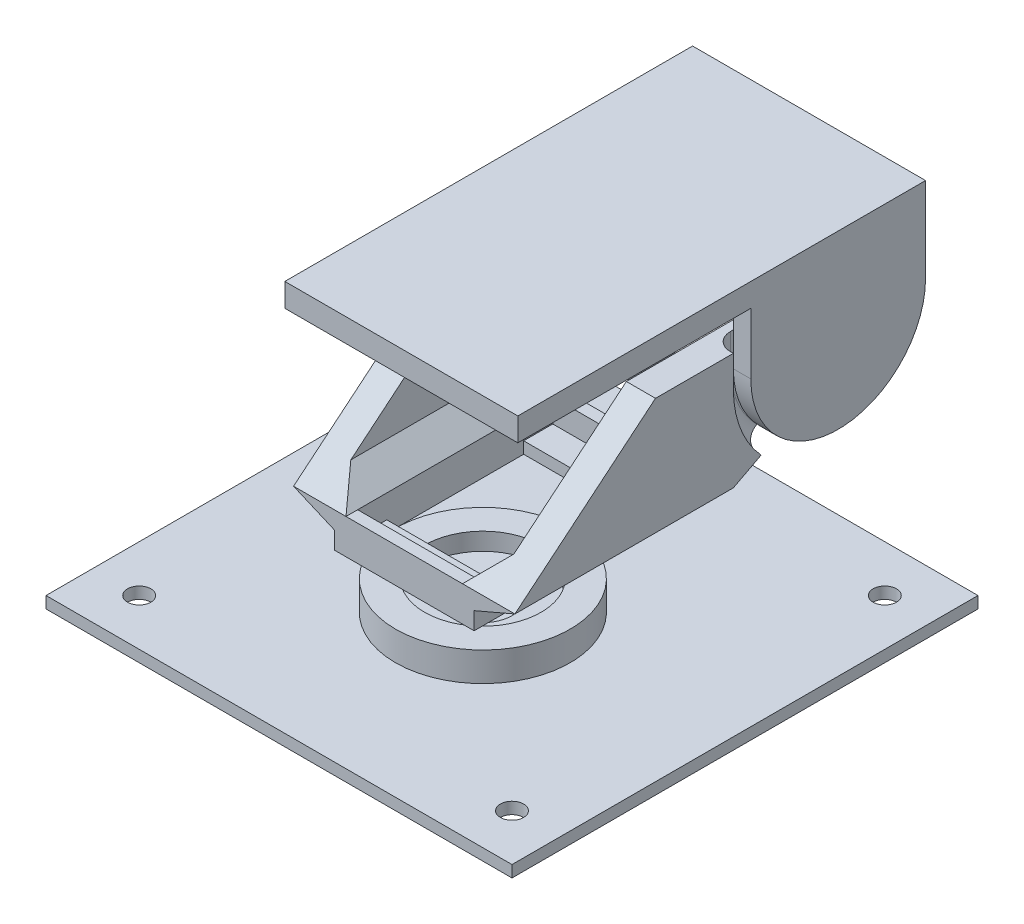
from build123d import *

# Parameters (mm, degrees)
SKETCH1_W            = 80
SKETCH1_H            = 80
BOSS_EXTRUDE1_DEPTH  = 2
SKETCH2_R            = 15
SKETCH2_R_2          = 5
BOSS_EXTRUDE2_DEPTH  = 5
SKETCH13_R           = 10
CUT_EXTRUDE1_DEPTH   = 3
BOSS_EXTRUDE3_START  = 10
SKETCH4_W            = 24
SKETCH4_H            = 37.5
SKETCH4_W_2          = 20
SKETCH4_H_2          = 33.5
BOSS_EXTRUDE3_DEPTH  = 6
BOSS_EXTRUDE4_START  = 2
SKETCH5_R            = 1.3
BOSS_EXTRUDE4_DEPTH  = 5
BOSS_EXTRUDE5_REACH  = 83.879
SKETCH10_W           = 20
SKETCH10_H           = 5
BOSS_EXTRUDE8_DEPTH  = 2
CUT_EXTRUDE3_DEPTH   = 10
SKETCH9_R            = 1.3
BOSS_EXTRUDE7_DEPTH  = 2
SKETCH14_R           = 2
CUT_EXTRUDE2_DEPTH   = 2
BOSS_EXTRUDE11_START = 33
SKETCH9_3_R          = 1.3
BOSS_EXTRUDE11_DEPTH = 2
BOSS_EXTRUDE6_START  = 5.195652
SKETCH7_W            = 40
SKETCH7_H            = 70
BOSS_EXTRUDE6_DEPTH  = 4
BOSS_EXTRUDE12_START = 22
BOSS_EXTRUDE12_DEPTH = 3
BOSS_EXTRUDE13_DEPTH = 3
CUT_EXTRUDE4_DEPTH   = 3.5
FILLET1_R            = 3


with BuildPart() as part:
    # Sketch1 → Boss-Extrude1 (new body)
    with BuildSketch(Plane(origin=(0, 0, 0), x_dir=(1, 0, 0), z_dir=(0, 1, 0))):
        Rectangle(SKETCH1_W, SKETCH1_H)
    extrude(amount=BOSS_EXTRUDE1_DEPTH)

    # Sketch2 → Boss-Extrude2 (add)
    with BuildSketch(Plane(origin=(0, 2, 0), x_dir=(1, 0, 0), z_dir=(0, 1, 0))):
        with Locations(Location((0, -5, 0), (0, 0, 270))):
            Circle(SKETCH2_R)
        with Locations(Location((0, -5, 0), (0, 0, 270))):
            Circle(SKETCH2_R_2, mode=Mode.SUBTRACT)
    extrude(amount=BOSS_EXTRUDE2_DEPTH)

    # Sketch13 → Cut-Extrude1 (cut)
    with BuildSketch(Plane(origin=(0, 7, 0), x_dir=(1, 0, 0), z_dir=(0, 1, 0))):
        with Locations(Location((0, -5, 0), (0, 0, 270))):
            Circle(SKETCH13_R)
    extrude(amount=-CUT_EXTRUDE1_DEPTH, mode=Mode.SUBTRACT)

    # Sketch14 → Cut-Extrude2 (cut)
    with BuildSketch(Plane(origin=(0, 2, 0), x_dir=(1, 0, 0), z_dir=(0, 1, 0))):
        with Locations(Location((-32, 32, 0), (0, 0, 270))):
            Circle(SKETCH14_R)
        with Locations(Location((32, 32, 0), (0, 0, 270))):
            Circle(SKETCH14_R)
        with Locations(Location((32, -32, 0), (0, 0, 270))):
            Circle(SKETCH14_R)
        with Locations(Location((-32, -32, 0), (0, 0, 270))):
            Circle(SKETCH14_R)
    extrude(amount=-CUT_EXTRUDE2_DEPTH, mode=Mode.SUBTRACT)


with BuildPart() as body_2:
    # Sketch4 → Boss-Extrude3 (new body)
    with BuildSketch(Plane(origin=(0, 2, 0), x_dir=(1, 0, 0), z_dir=(0, 1, 0)).offset(BOSS_EXTRUDE3_START)):
        with Locations((0, 0.25)):
            Rectangle(SKETCH4_W, SKETCH4_H)
        with Locations((0, 0.25)):
            Rectangle(SKETCH4_W_2, SKETCH4_H_2, mode=Mode.SUBTRACT)
    extrude(amount=BOSS_EXTRUDE3_DEPTH)



with BuildPart() as body_3:
    # Sketch5 → Boss-Extrude4 (new body)
    with BuildSketch(Plane.ZY.offset(12).offset(BOSS_EXTRUDE4_START)):
        Polygon((-42, 38), (-5.633281563, 38), (18.5, 18), (-19, 18), (-42, 30), align=None)
        with Locations((-37, 32.695652174)):
            Circle(SKETCH5_R, mode=Mode.SUBTRACT)
    extrude(amount=BOSS_EXTRUDE4_DEPTH)


with BuildPart() as body_2_1:
    add(body_2.part)

    add(body_3.part)  # Boss-Extrude5 merges body 3
    # Boss-Extrude5: up to this plane
    boss_extrude5_end = Plane(origin=(-19, 18, -19), z_dir=(0, 0.8865848461654549, 0.4625660066950196))
    # Sketch6 → Boss-Extrude5 (add, up to the surface)
    with BuildSketch(Plane.XY.offset(18.5), mode=Mode.PRIVATE) as boss_extrude5_sk1:
        Polygon((-19, 18), (-12, 15), (-12, 18), (-10, 18), (-14, 22), (-14, 18), align=None)
    boss_extrude5_tool1 = split(extrude(boss_extrude5_sk1.sketch, amount=-BOSS_EXTRUDE5_REACH, mode=Mode.PRIVATE), bisect_by=boss_extrude5_end, keep=Keep.BOTH, mode=Mode.PRIVATE)
    add(boss_extrude5_tool1.solids().sort_by_distance((-13.612613, 18.009009, 18.5))[0])

    # Sketch10 → Boss-Extrude8 (add)
    with BuildSketch(Plane.XZ.offset(-12)):
        with Locations((0, 14)):
            Rectangle(SKETCH10_W, SKETCH10_H)
        with Locations((0, -14.5)):
            Rectangle(SKETCH10_W, SKETCH10_H)
    extrude(amount=-BOSS_EXTRUDE8_DEPTH)

    # Sketch20 → Cut-Extrude3 (cut)
    with BuildSketch(Plane.ZY.offset(14)):
        Polygon((18.5, 18), (13.673343687, 22), (18.5, 22), align=None)
    extrude(amount=-CUT_EXTRUDE3_DEPTH, mode=Mode.SUBTRACT)

    # Mirror2: body 2 across plane


with BuildPart() as body_2_2:
    add(body_2_1.part)
    add(body_2_1.part.mirror(Plane(origin=(0, 0, 0), x_dir=(0, 0, 1), z_dir=(1, 0, 0))))

    # Sketch26 → Cut-Extrude4 (cut)
    with BuildSketch(Plane(origin=(19, 0, 0), x_dir=(0, 0, -1), z_dir=(1, 0, 0))):
        with BuildLine():
            Line((-21, 40.195652174), (19, 40.195652174))
            Line((19, 40.195652174), (19, 32.695652174))
            ThreePointArc((19, 32.695652174), (37, 14.695652174), (55, 32.695652174))
            Line((55, 32.695652174), (55, 50.195652174))
            Line((55, 50.195652174), (-21, 50.195652174))
            Line((-21, 50.195652174), (-21, 40.195652174))
        make_face()
    extrude(amount=-CUT_EXTRUDE4_DEPTH, mode=Mode.SUBTRACT)

    # Fillet1
    fillet1_edges = [body_2_2.edges().sort_by_distance(p)[0] for p in [
        (15.5, 26.14280534, -20.235149915),
        (15.5, 35.347826087, -19),
    ]]
    fillet(fillet1_edges, radius=FILLET1_R)


with BuildPart() as body_3_2:
    # Sketch9 → Boss-Extrude7 (new body)
    with BuildSketch(Plane(origin=(-19, 0, 0), x_dir=(0, 0, -1), z_dir=(1, 0, 0))):
        with BuildLine():
            Line((42, 43.195652174), (38.926692968, 32.159131713))
            ThreePointArc((38.926692968, 32.159131713), (37, 30.695652174), (35.073307032, 32.159131713))
            Line((35.073307032, 32.159131713), (32, 43.195652174))
            Line((32, 43.195652174), (42, 43.195652174))
        make_face()
        with Locations((37, 32.695652174)):
            Circle(SKETCH9_R, mode=Mode.SUBTRACT)
    extrude(amount=-BOSS_EXTRUDE7_DEPTH)

    # Sketch7 → Boss-Extrude6 (add)
    with BuildSketch(Plane(origin=(0, 38, 0), x_dir=(1, 0, 0), z_dir=(0, 1, 0)).offset(BOSS_EXTRUDE6_START)):
        with Locations((-1, 17)):
            Rectangle(SKETCH7_W, SKETCH7_H)
    extrude(amount=BOSS_EXTRUDE6_DEPTH)

    # Sketch12 → Boss-Extrude12 (add)
    with BuildSketch(Plane(origin=(-14, 0, 0), x_dir=(0, 0, -1), z_dir=(1, 0, 0)).offset(BOSS_EXTRUDE12_START)):
        Polygon((15.5, 26.672940532), (20, 26.672940532), (20, 34.695652174), (16, 43.195652174), (11.5, 43.195652174), align=None)
        Polygon((48, 26.672940532), (43.5, 26.672940532), (43.5, 34.695652174), (47.5, 43.195652174), (52, 43.195652174), align=None)
    extrude(amount=-BOSS_EXTRUDE12_DEPTH)

    # Sketch25 → Boss-Extrude13 (add)
    with BuildSketch(Plane(origin=(19, 0, 0), x_dir=(0, 0, -1), z_dir=(1, 0, 0))):
        with BuildLine():
            Line((22, 32.695652174), (22, 43.195652174))
            Line((22, 43.195652174), (52, 43.195652174))
            Line((52, 43.195652174), (52, 32.695652174))
            ThreePointArc((52, 32.695652174), (37, 17.695652174), (22, 32.695652174))
        make_face()
    extrude(amount=-BOSS_EXTRUDE13_DEPTH)


with BuildPart() as body_4:
    # Sketch9<3> → Boss-Extrude11 (new body)
    with BuildSketch(Plane(origin=(-19, 0, 0), x_dir=(0, 0, -1), z_dir=(1, 0, 0)).offset(BOSS_EXTRUDE11_START)):
        with BuildLine():
            Line((42, 43.195652174), (38.926692968, 32.159131713))
            ThreePointArc((38.926692968, 32.159131713), (37, 30.695652174), (35.073307032, 32.159131713))
            Line((35.073307032, 32.159131713), (32, 43.195652174))
            Line((32, 43.195652174), (42, 43.195652174))
        make_face()
        with Locations((37, 32.695652174)):
            Circle(SKETCH9_3_R, mode=Mode.SUBTRACT)
    extrude(amount=BOSS_EXTRUDE11_DEPTH)


with BuildPart() as body_5:
    # Sketch19 → Revolve1 (revolve)
    with BuildSketch(Plane(origin=(0, 39.904576281, -11.112108685), x_dir=(1, 0, 0), z_dir=(0, 0.9633464842335737, -0.268260230587415)), mode=Mode.PRIVATE) as revolve1_sk:
        Polygon((-21, 25.572876725), (-21, 25.372876725), (-21.5, 25.372876725), (-21.5, 26.872876725), (-21, 26.872876725), (-20.5, 26.872876725), (-20.5, 26.222876725), (-14, 26.222876725), (-14, 25.572876725), align=None)
    revolve(revolve1_sk.sketch.rotate(Axis((-14, 32.695652174, -37), (-1, 0, 0)), 164.439233372), axis=Axis((-14, 32.695652174, -37), (-1, 0, 0)))


with BuildPart() as body_6:
    # Sketch23 → Revolve2 (revolve)
    with BuildSketch(Plane(origin=(0, 39.904576281, -11.112108685), x_dir=(1, 0, 0), z_dir=(0, 0.9633464842335737, -0.268260230587415)), mode=Mode.PRIVATE) as revolve2_sk:
        Polygon((-20.5, 26.872876725), (-14, 26.872876725), (-13, 26.872876725), (-13, 28.372876725), (-14, 28.372876725), (-14, 27.522876725), (-20.5, 27.522876725), align=None)
    revolve(revolve2_sk.sketch.rotate(Axis((-20.5, 32.695652174, -37), (1, 0, 0)), 195.560766628), axis=Axis((-20.5, 32.695652174, -37), (1, 0, 0)))


solid = Compound([part.part, body_2_2.part, body_3_2.part, body_5.part, body_6.part])
